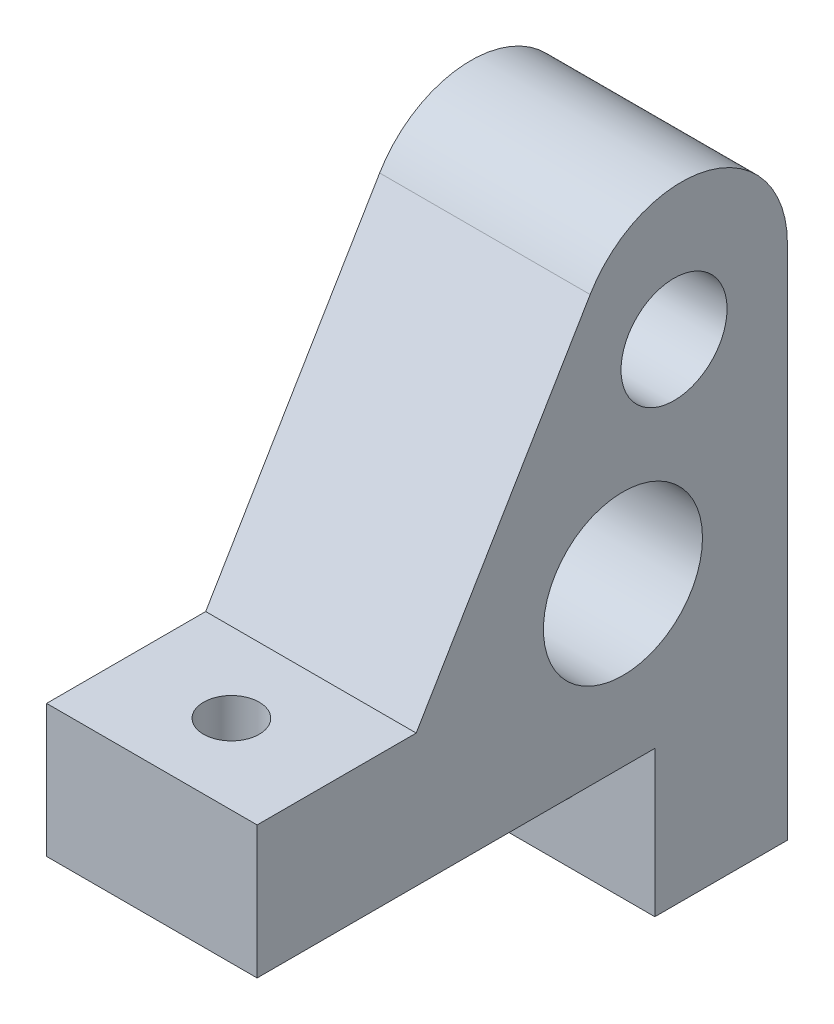
from build123d import *

# Parameters (mm, degrees)
RESSALTO_EXTRUS_O1_DEPTH                       = 7.94
BROCA_DE_ROSQUEAR_PARA_TARRAXA_DE_M5X0_8_D     = 4.2
BROCA_DE_ROSQUEAR_PARA_TARRAXA_DE_M5X0_8_DEPTH = 20
BROCA_DE_ROSQUEAR_PARA_TARRAXA_DE_M5X0_8_TIP   = 1.2618073
BROCA_DE_ROSQUEAR_PARA_TARRAXA_DE_M5_2_D       = 4.2
BROCA_DE_ROSQUEAR_PARA_TARRAXA_DE_M5_2_DEPTH   = 20
BROCA_DE_ROSQUEAR_PARA_TARRAXA_DE_M5_2_TIP     = 1.2618073
BROCA_DE_ROSQUEAR_PARA_TARRAXA_DE_M5_3_D       = 4.2
BROCA_DE_ROSQUEAR_PARA_TARRAXA_DE_M5_3_DEPTH   = 20
BROCA_DE_ROSQUEAR_PARA_TARRAXA_DE_M5_3_TIP     = 1.2618073
BROCA_DE_ROSQUEAR_PARA_TARRAXA_DE_M5_4_D       = 4.2
BROCA_DE_ROSQUEAR_PARA_TARRAXA_DE_M5_4_DEPTH   = 20
BROCA_DE_ROSQUEAR_PARA_TARRAXA_DE_M5_4_TIP     = 1.2618073
ESBO_O10_R                                     = 6
ESBO_O10_R_2                                   = 4
CORTE_EXTRUS_O1_DEPTH                          = 57.108594707


with BuildPart() as part:
    # Esboço1 → Ressalto-extrusão1 (new, symmetric)
    with BuildSketch(Plane(origin=(0, 0, 0), x_dir=(0, 0, -1), z_dir=(1, 0, 0))):
        with BuildLine():
            Line((-40, 0), (-10, 0))
            Line((-10, 0), (-10, -11))
            Line((-10, -11), (0, -11))
            Line((0, -11), (0, 0))
            Line((0, 0), (0, 28))
            ThreePointArc((0, 28), (-5.881190502, 35.714314377), (-14.877661578, 32.086290643))
            Line((-14.877661578, 32.086290643), (-28, 10))
            Line((-28, 10), (-40, 10))
            Line((-40, 10), (-40, 0))
        make_face()
    extrude(amount=RESSALTO_EXTRUS_O1_DEPTH, both=True)

    # Broca de rosquear para tarraxa de M5x0.8
    with Locations(Plane(origin=(33.065, 10, -11.460196829), x_dir=(1, 0, 0), z_dir=(0, 1, 0))):
        with Locations((33.06, -45.460196829), (-33.065, -45.460196829)):
            Hole(BROCA_DE_ROSQUEAR_PARA_TARRAXA_DE_M5X0_8_D / 2, depth=BROCA_DE_ROSQUEAR_PARA_TARRAXA_DE_M5X0_8_DEPTH)
            with Locations((0, 0, -(BROCA_DE_ROSQUEAR_PARA_TARRAXA_DE_M5X0_8_DEPTH + BROCA_DE_ROSQUEAR_PARA_TARRAXA_DE_M5X0_8_TIP / 2))):  # 118° drill point
                Cone(0, BROCA_DE_ROSQUEAR_PARA_TARRAXA_DE_M5X0_8_D / 2, BROCA_DE_ROSQUEAR_PARA_TARRAXA_DE_M5X0_8_TIP, mode=Mode.SUBTRACT)

    # Broca de rosquear para tarraxa de M5 2
    with Locations(Plane(origin=(-33.06, 10, -11.460196829), x_dir=(1, 0, 0), z_dir=(0, 1, 0))):
        with Locations((33.06, -45.460196829), (-33.065, -45.460196829)):
            Hole(BROCA_DE_ROSQUEAR_PARA_TARRAXA_DE_M5_2_D / 2, depth=BROCA_DE_ROSQUEAR_PARA_TARRAXA_DE_M5_2_DEPTH)
            with Locations((0, 0, -(BROCA_DE_ROSQUEAR_PARA_TARRAXA_DE_M5_2_DEPTH + BROCA_DE_ROSQUEAR_PARA_TARRAXA_DE_M5_2_TIP / 2))):  # 118° drill point
                Cone(0, BROCA_DE_ROSQUEAR_PARA_TARRAXA_DE_M5_2_D / 2, BROCA_DE_ROSQUEAR_PARA_TARRAXA_DE_M5_2_TIP, mode=Mode.SUBTRACT)

    # Broca de rosquear para tarraxa de M5 3
    with Locations(Plane(origin=(33.065, -48.751665499, 0), x_dir=(-1, 0, 0), z_dir=(0, 0, -1))):
        with Locations((-33.06, 43.751665499), (33.065, 43.751665499)):
            Hole(BROCA_DE_ROSQUEAR_PARA_TARRAXA_DE_M5_3_D / 2, depth=BROCA_DE_ROSQUEAR_PARA_TARRAXA_DE_M5_3_DEPTH)
            with Locations((0, 0, -(BROCA_DE_ROSQUEAR_PARA_TARRAXA_DE_M5_3_DEPTH + BROCA_DE_ROSQUEAR_PARA_TARRAXA_DE_M5_3_TIP / 2))):  # 118° drill point
                Cone(0, BROCA_DE_ROSQUEAR_PARA_TARRAXA_DE_M5_3_D / 2, BROCA_DE_ROSQUEAR_PARA_TARRAXA_DE_M5_3_TIP, mode=Mode.SUBTRACT)

    # Broca de rosquear para tarraxa de M5 4
    with Locations(Plane(origin=(-33.06, -48.751665499, 0), x_dir=(-1, 0, 0), z_dir=(0, 0, -1))):
        with Locations((-33.06, 43.751665499), (33.065, 43.751665499)):
            Hole(BROCA_DE_ROSQUEAR_PARA_TARRAXA_DE_M5_4_D / 2, depth=BROCA_DE_ROSQUEAR_PARA_TARRAXA_DE_M5_4_DEPTH)
            with Locations((0, 0, -(BROCA_DE_ROSQUEAR_PARA_TARRAXA_DE_M5_4_DEPTH + BROCA_DE_ROSQUEAR_PARA_TARRAXA_DE_M5_4_TIP / 2))):  # 118° drill point
                Cone(0, BROCA_DE_ROSQUEAR_PARA_TARRAXA_DE_M5_4_D / 2, BROCA_DE_ROSQUEAR_PARA_TARRAXA_DE_M5_4_TIP, mode=Mode.SUBTRACT)

    # Esboço10 → Corte-extrusão1 (cut, through all)
    with BuildSketch(Plane(origin=(7.94, 0, 0), x_dir=(0, 0, -1), z_dir=(1, 0, 0))):
        with Locations((-12.404989074, 11.961998196)):
            Circle(ESBO_O10_R)
        with Locations((-8.551110249, 25.993478071)):
            Circle(ESBO_O10_R_2)
    extrude(amount=-CORTE_EXTRUS_O1_DEPTH, mode=Mode.SUBTRACT)


solid = part.part
